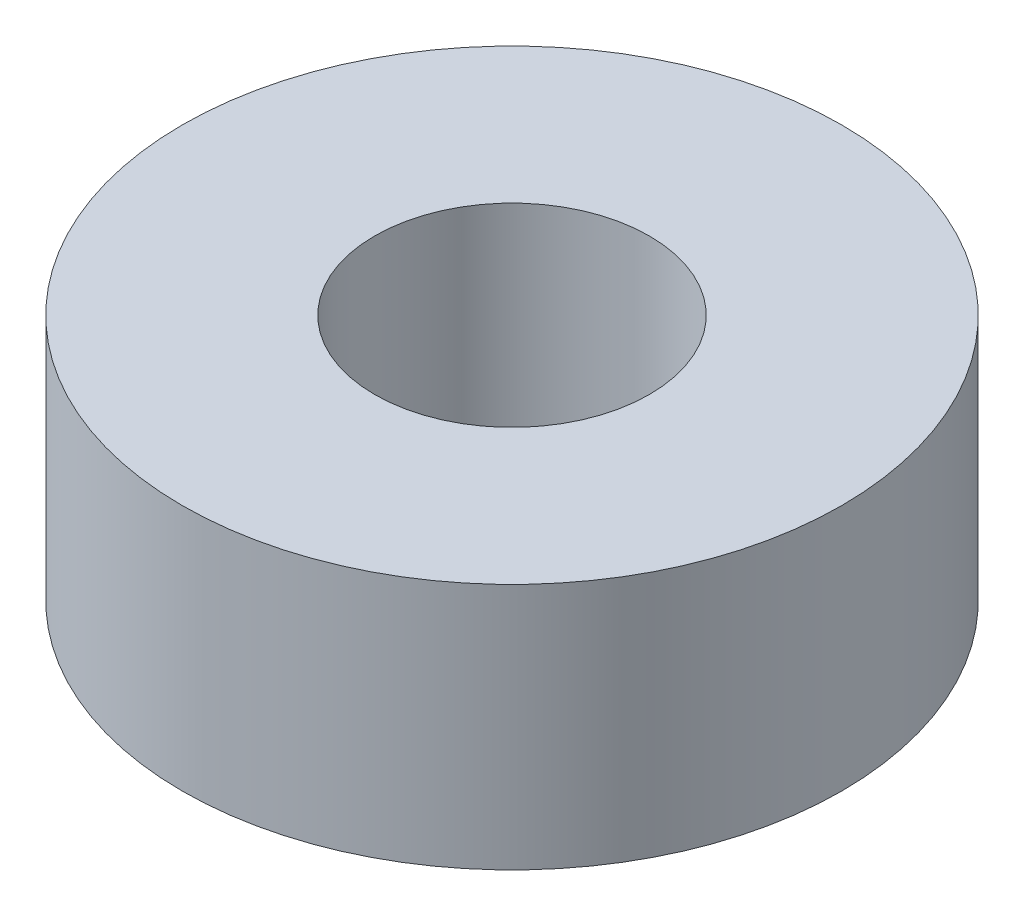
from build123d import *

# Parameters (mm, degrees)
SKETCH1_R           = 6
SKETCH1_R_2         = 2.5
BOSS_EXTRUDE1_DEPTH = 4.5


with BuildPart() as part:
    # Sketch1 → Boss-Extrude1 (new body)
    with BuildSketch(Plane(origin=(0, 0, 0), x_dir=(1, 0, 0), z_dir=(0, 1, 0))):
        with Locations(Location((0, 0, 0), (0, 0, 270))):
            Circle(SKETCH1_R)
        with Locations(Location((0, 0, 0), (0, 0, 270))):
            Circle(SKETCH1_R_2, mode=Mode.SUBTRACT)
    extrude(amount=BOSS_EXTRUDE1_DEPTH)


solid = part.part
